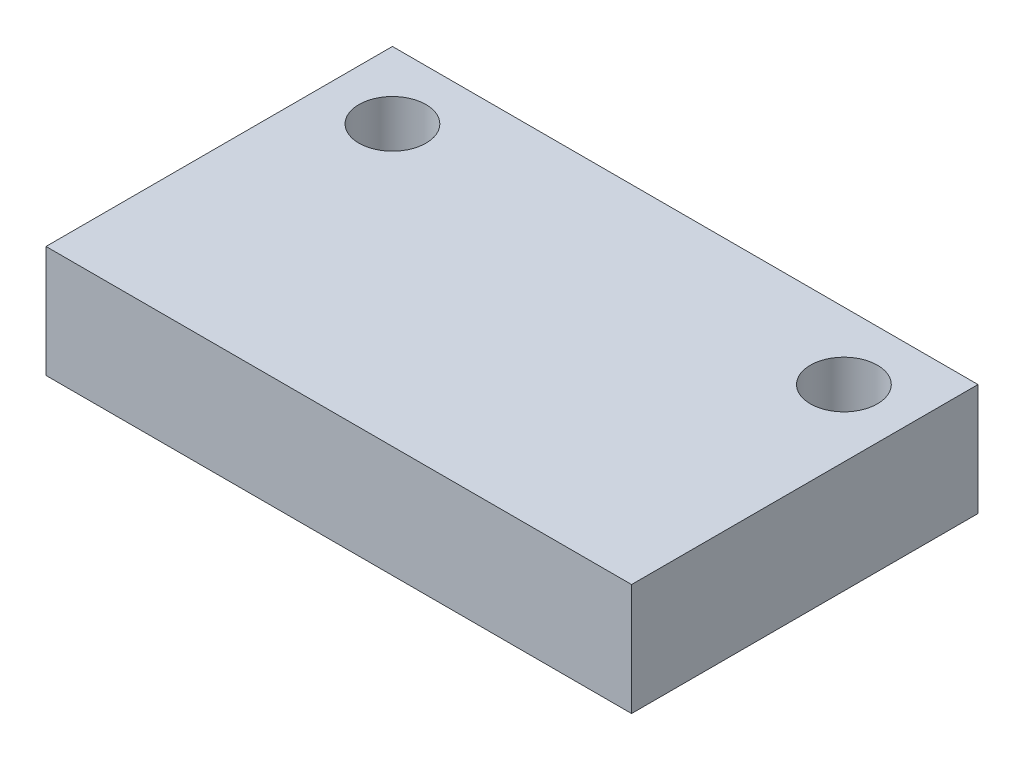
from build123d import *

# Parameters (mm, degrees)
SKETCH1_W           = 26.2
SKETCH1_H           = 15.5
BOSS_EXTRUDE1_DEPTH = 5
SKETCH2_R           = 1.5
CUT_EXTRUDE1_DEPTH  = 5


with BuildPart() as part:
    # Sketch1 → Boss-Extrude1 (new body)
    with BuildSketch(Plane(origin=(0, 0, 0), x_dir=(1, 0, 0), z_dir=(0, 1, 0))):
        Rectangle(SKETCH1_W, SKETCH1_H)
    extrude(amount=BOSS_EXTRUDE1_DEPTH)

    # Sketch2 → Cut-Extrude1 (cut)
    with BuildSketch(Plane(origin=(0, 5, 0), x_dir=(1, 0, 0), z_dir=(0, 1, 0))):
        with Locations(Location((-10.1, 4.75, 0), (0, 0, 270))):
            Circle(SKETCH2_R)
        with Locations(Location((10.1, 4.75, 0), (0, 0, 270))):
            Circle(SKETCH2_R)
    extrude(amount=-CUT_EXTRUDE1_DEPTH, mode=Mode.SUBTRACT)


solid = part.part
